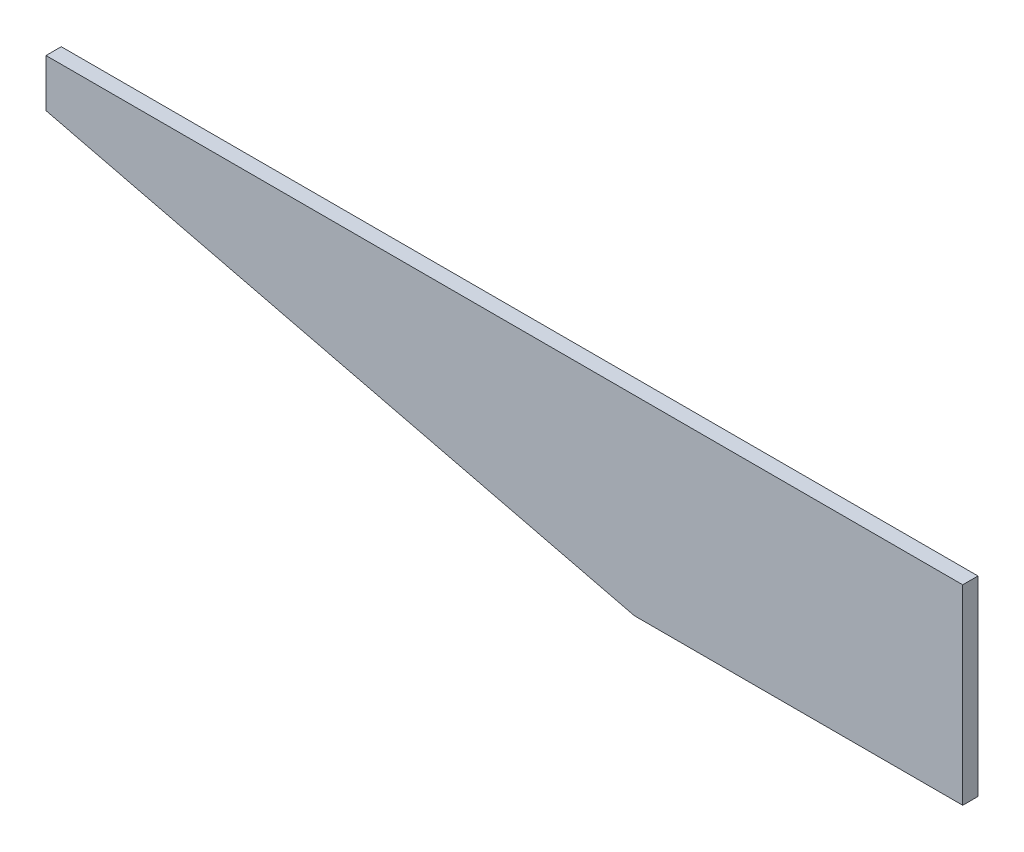
from build123d import *

# Parameters (mm, degrees)
BOSS_EXTRU_1_DEPTH = 10


with BuildPart() as part:
    # Esquisse1 → Boss.-Extru.1 (new body)
    with BuildSketch(Plane.XY):
        Polygon((-600, 0), (0, 0), (0, -125), (-215, -125), (-600, -31.25), align=None)
    extrude(amount=-BOSS_EXTRU_1_DEPTH)


solid = part.part
